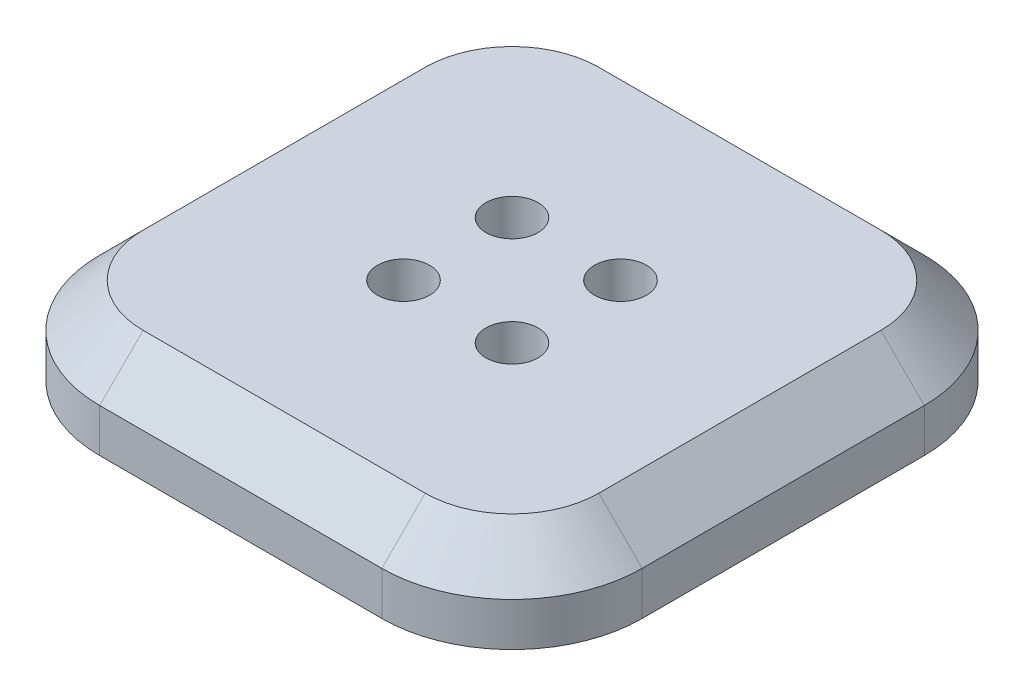
from build123d import *

# Parameters (mm, degrees)
SKETCH_1_W                 = 125
SKETCH_1_H                 = 125
EXTRUDE_1_DEPTH            = 20
FILLET_1_R                 = 30
CHAMFER_1_SIZE             = 10
F_20_0MM_1_D               = 12
F_20_0MM_1_DEPTH           = 10
F_20_0MM_1_TIP             = 3.605163714
F_20_0MM_1_ON_FACE_2_D     = 12
F_20_0MM_1_ON_FACE_2_DEPTH = 10
F_20_0MM_1_ON_FACE_2_TIP   = 3.605163714


with BuildPart() as part:
    # 草圖1 → 填料-伸長1 (new body)
    with BuildSketch(Plane(origin=(0, 0, 0), x_dir=(1, 0, 0), z_dir=(0, 1, 0))):
        with Locations((62.5, 62.5)):
            Rectangle(SKETCH_1_W, SKETCH_1_H)
    extrude(amount=EXTRUDE_1_DEPTH)

    # 圓角1
    fillet_1_edges = [part.edges().sort_by_distance(p)[0] for p in [
        (0, 10, -125),
        (125, 10, -125),
        (125, 10, 0),
        (0, 10, 0),
    ]]
    fillet(fillet_1_edges, radius=FILLET_1_R)

    # 導角1
    chamfer_1_edges = [part.edges().sort_by_distance(p)[0] for p in [
        (0, 20, -62.5),
        (62.5, 20, -125),
        (62.5, 20, 0),
        (125, 20, -62.5),
        (8.786796564, 20, -8.786796564),
        (116.213203436, 20, -8.786796564),
        (116.213203436, 20, -116.213203436),
        (8.786796564, 20, -116.213203436),
    ]]
    chamfer(chamfer_1_edges, length=CHAMFER_1_SIZE)

    # Ø20.0mm 定位孔1
    with Locations(Plane(origin=(50, 20, -50), x_dir=(0, 0, 1), z_dir=(0, 1, 0))):
        with Locations((0, 0), (-25, 0), (-25, 25), (0, 25)):
            Hole(F_20_0MM_1_D / 2, depth=F_20_0MM_1_DEPTH)
            with Locations((0, 0, -(F_20_0MM_1_DEPTH + F_20_0MM_1_TIP / 2))):  # 118° drill point
                Cone(0, F_20_0MM_1_D / 2, F_20_0MM_1_TIP, mode=Mode.SUBTRACT)

    # Ø20.0mm 定位孔1 on face 2
    with Locations(Plane(origin=(25, 0, -25), x_dir=(0, 0, -1), z_dir=(0, -1, 0))):
        with Locations((0, 0), (0, 75), (75, 75), (75, 0)):
            Hole(F_20_0MM_1_ON_FACE_2_D / 2, depth=F_20_0MM_1_ON_FACE_2_DEPTH)
            with Locations((0, 0, -(F_20_0MM_1_ON_FACE_2_DEPTH + F_20_0MM_1_ON_FACE_2_TIP / 2))):  # 118° drill point
                Cone(0, F_20_0MM_1_ON_FACE_2_D / 2, F_20_0MM_1_ON_FACE_2_TIP, mode=Mode.SUBTRACT)


solid = part.part
